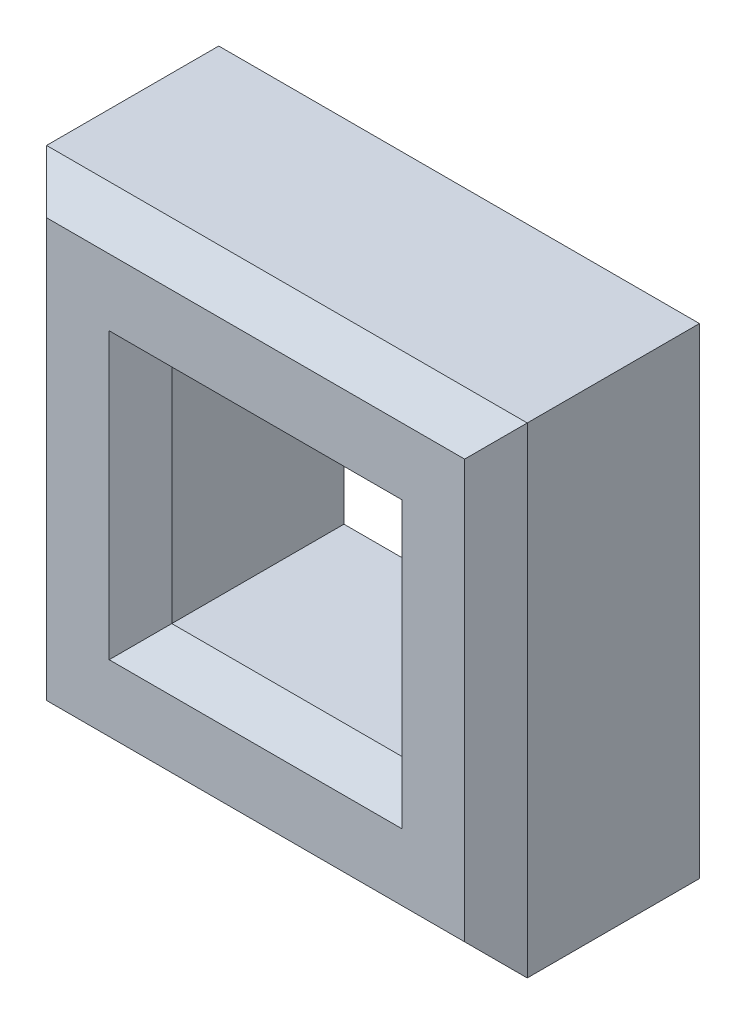
from build123d import *

# Parameters (mm, degrees)
SKETCH1_W           = 15.353910524
SKETCH1_H           = 15.353910524
SKETCH1_W_2         = 7.353910524
SKETCH1_H_2         = 7.1
BOSS_EXTRUDE1_DEPTH = 6.5
CHAMFER1_SIZE       = 1


with BuildPart() as part:
    # Sketch1 → Boss-Extrude1 (new body)
    with BuildSketch(Plane.XY):
        Rectangle(SKETCH1_W, SKETCH1_H)
        Rectangle(SKETCH1_W_2, SKETCH1_H_2, mode=Mode.SUBTRACT)
    extrude(amount=BOSS_EXTRUDE1_DEPTH)

    # Chamfer1
    chamfer1_edges = [part.edges().sort_by_distance(p)[0] for p in [
        (7.676955262, 0, 6.5),
        (-3.676955262, 0, 6.5),
        (0, 7.676955262, 6.5),
        (0, -3.55, 6.5),
        (3.676955262, 0, 6.5),
        (0, 3.55, 6.5),
        (-7.676955262, 0, 6.5),
        (0, -7.676955262, 6.5),
    ]]
    chamfer(chamfer1_edges, length=CHAMFER1_SIZE)


solid = part.part
